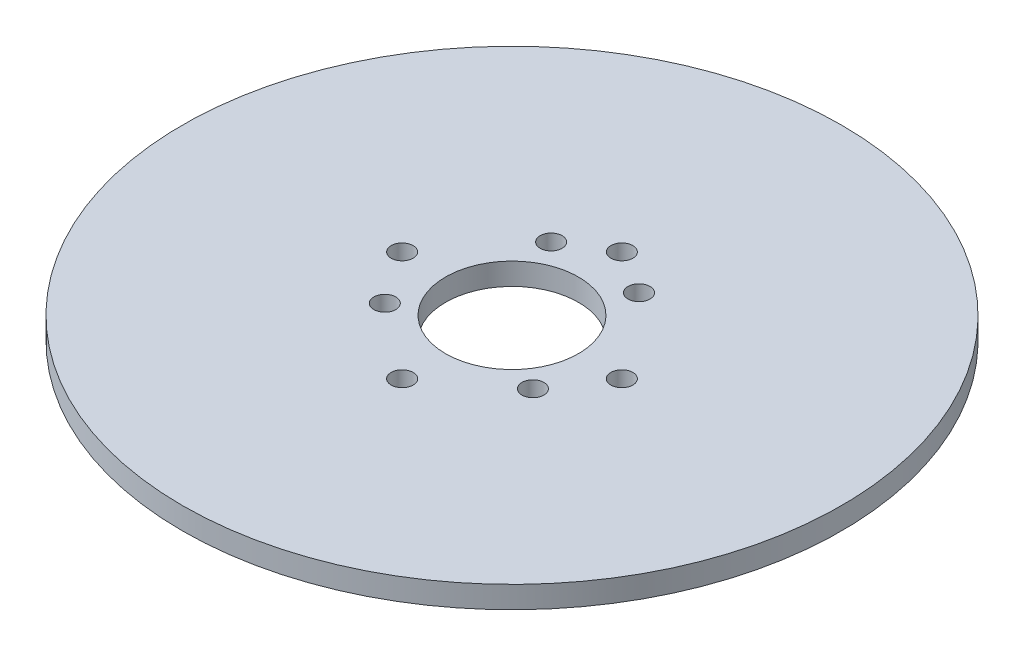
from build123d import *

# Parameters (mm, degrees)
SKETCH1_R           = 150
SKETCH1_R_2         = 5
SKETCH1_R_3         = 30.25
BOSS_EXTRUDE1_DEPTH = 10


with BuildPart() as part:
    # Sketch1 → Boss-Extrude1 (new body)
    with BuildSketch(Plane(origin=(0, 0, 0), x_dir=(1, 0, 0), z_dir=(0, 1, 0))):
        with Locations(Location((0, 2.5, 0), (0, 0, 270))):
            Circle(SKETCH1_R)
        with Locations(Location((-20, 40.311288741, 0), (0, 0, 270))):
            Circle(SKETCH1_R_2, mode=Mode.SUBTRACT)
        with Locations(Location((20, 40.311288741, 0), (0, 0, 270))):
            Circle(SKETCH1_R_2, mode=Mode.SUBTRACT)
        with Locations(Location((33.7, -21.693227223, 0), (0, 0, 270))):
            Circle(SKETCH1_R_2, mode=Mode.SUBTRACT)
        with Locations(Location((-33.7, -21.693227223, 0), (0, 0, 270))):
            Circle(SKETCH1_R_2, mode=Mode.SUBTRACT)
        with Locations(Location((0, 2.5, 0), (0, 0, 270))):
            Circle(SKETCH1_R_3, mode=Mode.SUBTRACT)
        with Locations(Location((0, 52.5, 0), (0, 0, 270))):
            Circle(SKETCH1_R_2, mode=Mode.SUBTRACT)
        with Locations(Location((50, 2.5, 0), (0, 0, 270))):
            Circle(SKETCH1_R_2, mode=Mode.SUBTRACT)
        with Locations(Location((0, -47.5, 0), (0, 0, 270))):
            Circle(SKETCH1_R_2, mode=Mode.SUBTRACT)
        with Locations(Location((-50, 2.5, 0), (0, 0, 270))):
            Circle(SKETCH1_R_2, mode=Mode.SUBTRACT)
    extrude(amount=BOSS_EXTRUDE1_DEPTH)


solid = part.part
